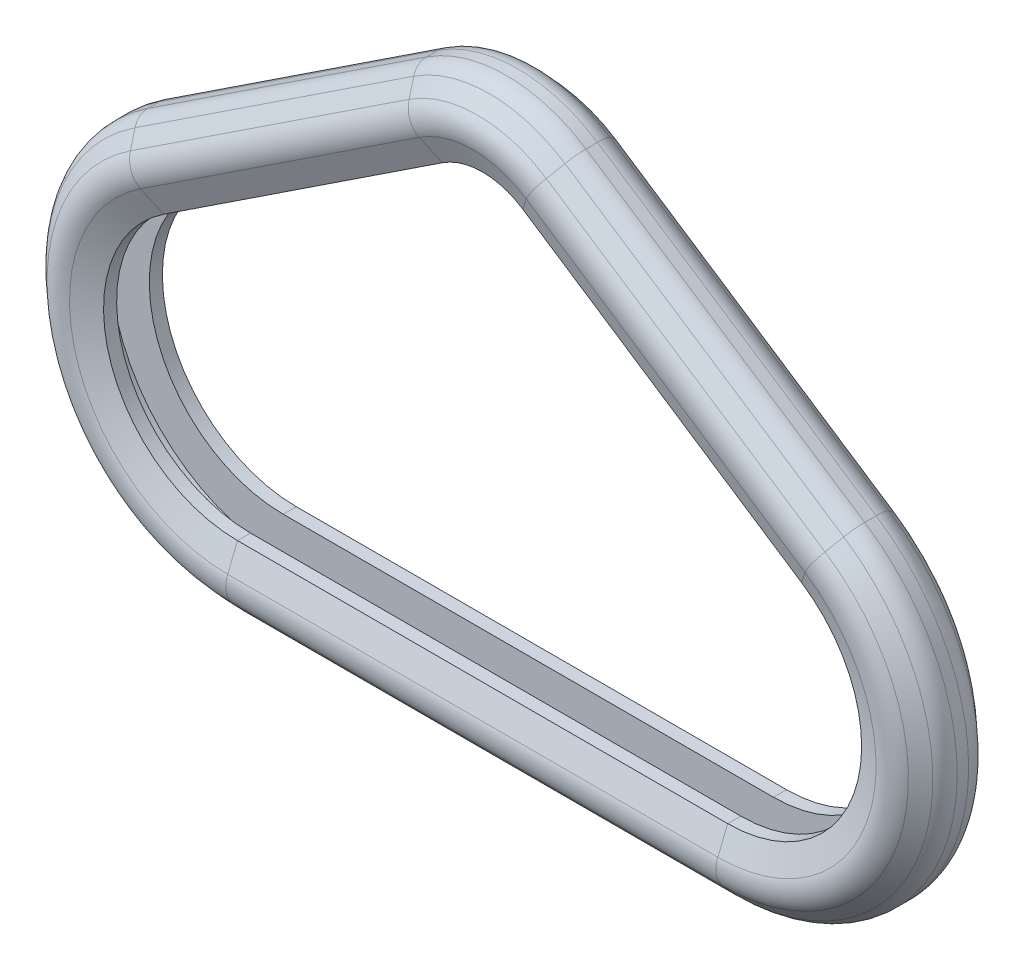
from build123d import *


with BuildPart() as part:
    # Balayage1: sweep along a path in Esquisse1
    with BuildLine(Plane.XY) as balayage1_path:
        Line((48.792061638, 17.109637903), (6.141771071, 45.25804309))
        ThreePointArc((6.141771071, 45.25804309), (0, 47.102069304), (-6.141771071, 45.25804309))
        Line((-6.141771071, 45.25804309), (-48.792061638, 17.109637903))
        ThreePointArc((-48.792061638, 17.109637903), (-57.134139235, -5.895015818), (-37.50001617, -20.5))
        Line((-37.50001617, -20.5), (37.50001617, -20.5))
        ThreePointArc((37.50001617, -20.5), (57.134139235, -5.895015818), (48.792061638, 17.109637903))
    # Esquisse2 → Balayage1 (sweep)
    with BuildSketch(Plane(origin=(0, 0, 0), x_dir=(0, 0, -1), z_dir=(1, 0, 0))):
        with BuildLine():
            Line((-4.5, -20.5), (-2.5, -20.5))
            Line((-2.5, -20.5), (-2.5, -26.5))
            Line((-2.5, -26.5), (2.5, -26.5))
            Line((2.5, -26.5), (2.5, -20.5))
            Line((2.5, -20.5), (4.5, -20.5))
            Line((4.5, -20.5), (6, -24.208099244))
            ThreePointArc((6, -24.208099244), (6.228715258, -26.416259945), (5.244821685, -28.406294565))
            Line((5.244821685, -28.406294565), (3.458805812, -30.360920906))
            ThreePointArc((3.458805812, -30.360920906), (2.286874079, -31.202594508), (0.875, -31.5))
            Line((0.875, -31.5), (-0.875, -31.5))
            ThreePointArc((-0.875, -31.5), (-2.286874079, -31.202594508), (-3.458805812, -30.360920906))
            Line((-3.458805812, -30.360920906), (-5.244821685, -28.406294565))
            ThreePointArc((-5.244821685, -28.406294565), (-6.228715258, -26.416259945), (-6, -24.208099244))
            Line((-6, -24.208099244), (-4.5, -20.5))
        make_face()
    sweep(path=balayage1_path.line)


solid = part.part
